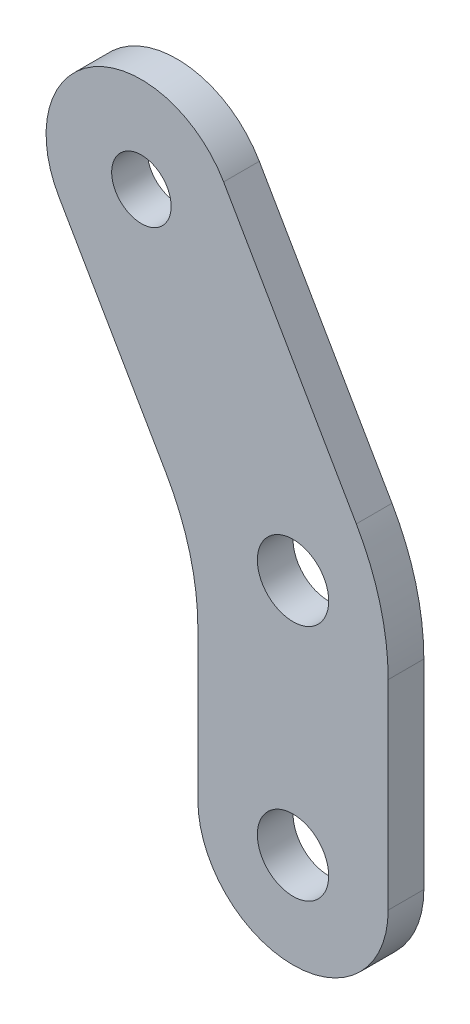
from build123d import *

# Parameters (mm, degrees)
SKETCH1_R           = 3
SKETCH1_R_2         = 2.5
BOSS_EXTRUDE1_DEPTH = 3
FILLET1_R           = 20


with BuildPart() as part:
    # Sketch1 → Boss-Extrude1 (new body)
    with BuildSketch(Plane.XY):
        with BuildLine():
            Line((-8, 0), (-8, 17.856406461))
            Line((-8, 17.856406461), (-19.692234478, 38.107950631))
            ThreePointArc((-19.692234478, 38.107950631), (-16.764031248, 49.036153861), (-5.835828018, 46.107950631))
            Line((-5.835828018, 46.107950631), (8, 22.143593539))
            Line((8, 22.143593539), (8, 0))
            ThreePointArc((8, 0), (0, -8), (-8, 0))
        make_face()
        Circle(SKETCH1_R, mode=Mode.SUBTRACT)
        with Locations((0, 20)):
            Circle(SKETCH1_R, mode=Mode.SUBTRACT)
        with Locations((-12.749783974, 42.112266724)):
            Circle(SKETCH1_R_2, mode=Mode.SUBTRACT)
    extrude(amount=BOSS_EXTRUDE1_DEPTH)

    # Fillet1
    fillet1_edges = [part.edges().sort_by_distance(p)[0] for p in [
        (-8, 17.856406461, 1.5),
        (8, 22.143593539, 1.5),
    ]]
    fillet(fillet1_edges, radius=FILLET1_R)


solid = part.part
